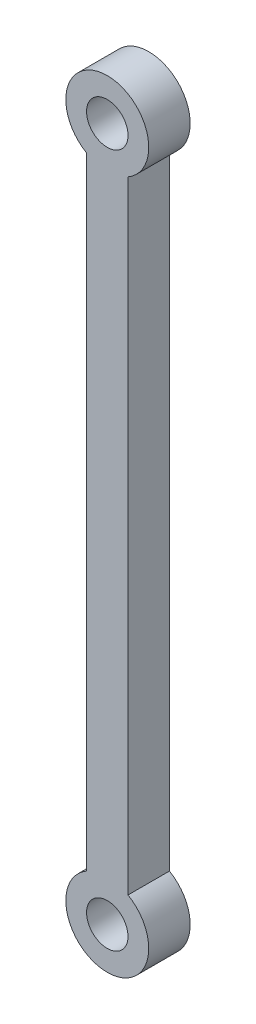
from build123d import *

# Parameters (mm, degrees)
SKETCH1_R           = 1
BOSS_EXTRUDE1_DEPTH = 2


with BuildPart() as part:
    # Sketch1 → Boss-Extrude1 (new body)
    with BuildSketch(Plane.XY):
        with BuildLine():
            Line((0, 0), (0, 30))
            ThreePointArc((0, 30), (1, 33.732050808), (2, 30))
            Line((2, 30), (2, 0))
            ThreePointArc((2, 0), (1, -3.732050808), (0, 0))
        make_face()
        with Locations((1, 31.732050808)):
            Circle(SKETCH1_R, mode=Mode.SUBTRACT)
        with Locations((1, -1.732050808)):
            Circle(SKETCH1_R, mode=Mode.SUBTRACT)
    extrude(amount=BOSS_EXTRUDE1_DEPTH)


solid = part.part
